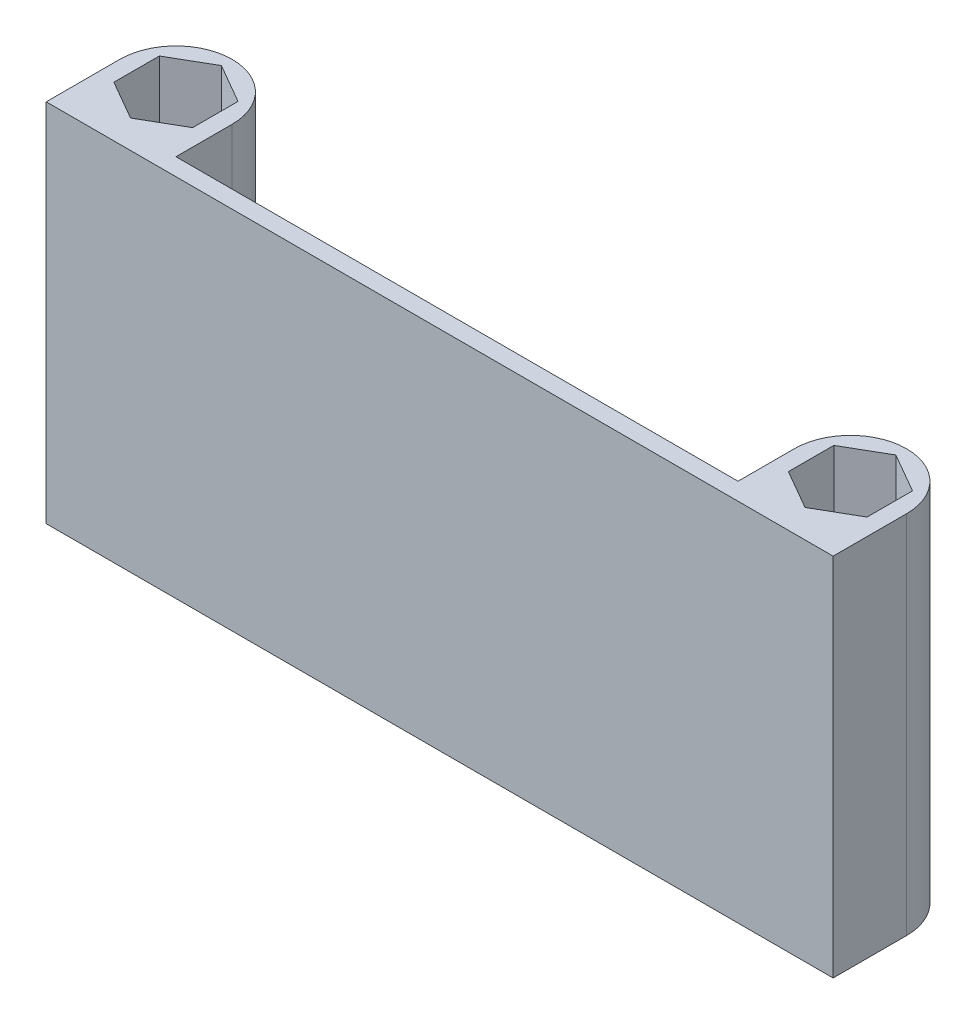
from build123d import *

# Parameters (mm, degrees)
BOSS_EXTRUDE1_DEPTH = 26
BOSS_EXTRUDE2_DEPTH = 2


with BuildPart() as part:
    # Sketch1 → Boss-Extrude1 (new body)
    with BuildSketch(Plane(origin=(0, 0, 0), x_dir=(1, 0, 0), z_dir=(0, 1, 0))):
        with BuildLine():
            Line((-28, 0), (-28, -5.233161507))
            Line((-28, -5.233161507), (28, -5.233161507))
            Line((28, -5.233161507), (28, 0))
            ThreePointArc((28, 0), (24, 4), (20, 0))
            Line((20, 0), (20, -4))
            Line((20, -4), (-20, -4))
            Line((-20, -4), (-20, 0))
            ThreePointArc((-20, 0), (-24, 4), (-28, 0))
        make_face()
        Polygon((-24, -3.233161507), (-21.2, -1.616580754), (-21.2, 1.616580754), (-24, 3.233161507), (-26.8, 1.616580754), (-26.8, -1.616580754), align=None, mode=Mode.SUBTRACT)
        Polygon((24, -3.233161507), (26.8, -1.616580754), (26.8, 1.616580754), (24, 3.233161507), (21.2, 1.616580754), (21.2, -1.616580754), align=None, mode=Mode.SUBTRACT)
    extrude(amount=BOSS_EXTRUDE1_DEPTH)

    # Sketch2 → Boss-Extrude2 (add)
    # profile 1 of 2: a face of its own
    with BuildSketch(Plane(origin=(0, 0, 4), x_dir=(-1, 0, 0), z_dir=(0, 0, -1))):
        with BuildLine():
            Line((-13.647058824, 23), (-7.511029412, 23))
            add(Edge.make_bspline(
                [(-7.511029412, 23), (-7.275731179, 22.997981779), (-6.819798363, 22.994071112), (-6.159048704, 22.98133809), (-5.542304381, 22.952753821), (-4.97019879, 22.906571513), (-4.43999705, 22.85840676), (-3.95570662, 22.791983867), (-3.515425024, 22.714754032), (-3.113311884, 22.62754473), (-2.741946911, 22.520639825), (-2.392633853, 22.391003364), (-2.061356263, 22.237036075), (-1.749186518, 22.056973854), (-1.455538155, 21.852418481), (-1.180448032, 21.624572715), (-0.921358069, 21.373380515), (-0.680179003, 21.096140802), (-0.459212321, 20.785039798), (-0.272594718, 20.428388227), (-0.114539747, 20.02893381), (0.01166681, 19.585017574), (0.11595967, 19.100276176), (0.182028181, 18.570062266), (0.228008391, 17.997136115), (0.232808413, 17.599367786), (0.235294118, 17.393382353)],
                knots=[0, 0, 0, 0, 1.509097582, 2.924149082, 4.238183516, 5.467880876, 6.60497888, 7.652028453, 8.60175528, 9.471282623, 10.289610236, 11.077949411, 11.85853237, 12.62964082, 13.386192643, 14.150986854, 14.917998976, 15.698027796, 16.504800181, 17.359170498, 18.272796439, 19.255228546, 20.31576025, 21.449539682, 22.679237042, 24, 24, 24, 24], degree=3))
            add(Edge.make_bspline(
                [(0.235294118, 17.393382353), (0.232974752, 17.254856933), (0.228515198, 16.98850749), (0.200383988, 16.605202315), (0.149069438, 16.255170164), (0.079129695, 15.936955638), (-0.005906464, 15.649717168), (-0.117746792, 15.395642258), (-0.249513114, 15.174191871), (-0.404256499, 14.979905609), (-0.591024507, 14.809913361), (-0.814712612, 14.657824833), (-1.072004992, 14.508015165), (-1.37363652, 14.380830632), (-1.707083821, 14.248019836), (-2.08498403, 14.138316996), (-2.498813667, 14.030114219), (-2.790094496, 13.971551743), (-2.941176471, 13.941176471)],
                knots=[0, 0, 0, 0, 1.248797497, 2.401122606, 3.461961877, 4.434949853, 5.336516199, 6.157599865, 6.930603047, 7.653512509, 8.388476874, 9.197582017, 10.088252902, 11.067492471, 12.144601044, 13.32232985, 14.611142055, 16, 16, 16, 16], degree=3))
            add(Edge.make_bspline(
                [(-2.941176471, 13.941176471), (-2.770371191, 13.906426369), (-2.441331923, 13.839483779), (-1.972356815, 13.710080705), (-1.546384653, 13.563684789), (-1.161438092, 13.403562089), (-0.820288891, 13.222788974), (-0.522021254, 13.024823635), (-0.263588432, 12.811780764), (-0.05097915, 12.573648761), (0.133439784, 12.315749283), (0.287925528, 12.026254146), (0.414834382, 11.704673071), (0.522237978, 11.351932642), (0.605600404, 10.96831546), (0.663113943, 10.5516397), (0.701055467, 10.10487322), (0.704241313, 9.795426457), (0.705882353, 9.636029412)],
                knots=[0, 0, 0, 0, 1.318474424, 2.539908949, 3.677602242, 4.724633259, 5.691096321, 6.593718157, 7.429479115, 8.217211742, 9.001882654, 9.823273564, 10.69276163, 11.613722017, 12.610358031, 13.659357769, 14.794327495, 16, 16, 16, 16], degree=3))
            Line((0.705882353, 9.636029412), (0.705882353, 7.757352941))
            add(Edge.make_bspline(
                [(0.705882353, 7.757352941), (0.704799402, 7.591884318), (0.702704249, 7.27175714), (0.67738761, 6.807934298), (0.632072604, 6.377720507), (0.577490967, 5.978821137), (0.492846489, 5.615803116), (0.405671971, 5.281599354), (0.28994872, 4.983831187), (0.160842329, 4.715033057), (0.012977275, 4.472562188), (-0.158442094, 4.255363641), (-0.345211479, 4.055514692), (-0.555509379, 3.876624389), (-0.785166734, 3.715553429), (-1.037562672, 3.576418256), (-1.307049122, 3.453168174), (-1.607705683, 3.35203056), (-1.957946085, 3.265715552), (-2.377158841, 3.195476641), (-2.873785211, 3.13277364), (-3.4493738, 3.088655391), (-4.103756338, 3.047411202), (-4.83799783, 3.018157261), (-5.650694295, 3.005897294), (-6.218135233, 3.002024237), (-6.514705882, 3)],
                knots=[0, 0, 0, 0, 1.152396282, 2.229506502, 3.233379135, 4.165256051, 5.030866667, 5.828132484, 6.56839727, 7.251703786, 7.90313474, 8.541689401, 9.175664088, 9.805199082, 10.461088127, 11.125968039, 11.809754162, 12.52233939, 13.331757138, 14.319645788, 15.481015661, 16.817142782, 18.339330194, 20.047761731, 21.934379081, 24, 24, 24, 24], degree=3))
            Line((-6.514705882, 3), (-13.647058824, 3))
            Line((-13.647058824, 3), (-13.647058824, 23))
        make_face()
        with BuildLine():
            Line((-7.529411765, 19.705882353), (-7.529411765, 15.235294118))
            add(Edge.make_bspline(
                [(-7.529411765, 15.235294118), (-7.406866635, 15.237978484), (-7.192422866, 15.242675901), (-6.977943364, 15.24522929), (-6.886029412, 15.246323529)],
                knots=[0, 0, 0, 0, 1.142911548, 2, 2, 2, 2], degree=3))
            add(Edge.make_bspline(
                [(-6.886029412, 15.246323529), (-6.740947301, 15.248687273), (-6.477856737, 15.252973663), (-6.125517198, 15.325927539), (-5.851081785, 15.437107788), (-5.684278021, 15.590100017), (-5.601180942, 15.752298454), (-5.553614641, 15.915978468), (-5.509206909, 16.121100191), (-5.474341123, 16.370628298), (-5.445721739, 16.665000056), (-5.423400941, 17.002143802), (-5.413861666, 17.38352185), (-5.412490731, 17.651958103), (-5.411764706, 17.794117647)],
                knots=[0, 0, 0, 0, 1.48265011, 2.688624062, 3.665886862, 4.482415445, 4.937118978, 5.516533753, 6.222944153, 7.08542788, 8.094324435, 9.251250026, 10.544306002, 12, 12, 12, 12], degree=3))
            add(Edge.make_bspline(
                [(-5.411764706, 17.794117647), (-5.414328018, 17.940093199), (-5.419057143, 18.209407536), (-5.458346473, 18.577258961), (-5.518349704, 18.87773136), (-5.617120488, 19.109882781), (-5.733904141, 19.290128296), (-5.868891145, 19.428124069), (-6.017897311, 19.536117272), (-6.198796129, 19.605125943), (-6.426159943, 19.646746329), (-6.722318383, 19.677870943), (-7.099011903, 19.698357172), (-7.37742421, 19.703224978), (-7.529411765, 19.705882353)],
                knots=[0, 0, 0, 0, 1.519775244, 2.803875429, 3.850524394, 4.696904465, 5.415553468, 6.074478191, 6.697696669, 7.316323432, 8.072315065, 9.09987747, 10.416799398, 12, 12, 12, 12], degree=3))
        make_face(mode=Mode.SUBTRACT)
        with BuildLine():
            Line((-7.529411765, 12.176470588), (-7.529411765, 6.294117647))
            add(Edge.make_bspline(
                [(-7.529411765, 6.294117647), (-7.420324785, 6.298478074), (-7.213005859, 6.306765029), (-6.918337489, 6.326902982), (-6.654951975, 6.361663585), (-6.420932841, 6.399065544), (-6.218252281, 6.450542123), (-6.047062066, 6.509147737), (-5.904616172, 6.57395291), (-5.788177353, 6.653131279), (-5.695063658, 6.755503737), (-5.618691129, 6.883359348), (-5.55127953, 7.03989887), (-5.504628482, 7.228008812), (-5.457915355, 7.44189207), (-5.430019896, 7.68684309), (-5.417623422, 7.96064691), (-5.413774101, 8.153174564), (-5.411764706, 8.253676471)],
                knots=[0, 0, 0, 0, 1.50566656, 2.861507154, 4.071047619, 5.168542278, 6.12771314, 6.950823291, 7.661450358, 8.28034255, 8.878344747, 9.553732332, 10.32599646, 11.219809833, 12.220801373, 13.344401423, 14.613743465, 16, 16, 16, 16], degree=3))
            Line((-5.411764706, 8.253676471), (-5.411764706, 10.216911765))
            add(Edge.make_bspline(
                [(-5.411764706, 10.216911765), (-5.411625539, 10.323574104), (-5.411361354, 10.526054691), (-5.431934549, 10.812872087), (-5.455941272, 11.068312667), (-5.490634178, 11.28988458), (-5.538399387, 11.478501022), (-5.596797759, 11.632421229), (-5.660721533, 11.759017199), (-5.746931785, 11.854699599), (-5.860081356, 11.921764358), (-5.99584109, 11.985178234), (-6.168589838, 12.034357698), (-6.373799547, 12.077524186), (-6.614452953, 12.113799181), (-6.88926906, 12.14220067), (-7.198264679, 12.164205556), (-7.415407511, 12.172248096), (-7.529411765, 12.176470588)],
                knots=[0, 0, 0, 0, 1.448679605, 2.750075608, 3.904849468, 4.934080626, 5.79427915, 6.542621099, 7.168507459, 7.710604877, 8.264840309, 8.942819976, 9.743425019, 10.697014228, 11.792022656, 13.047885967, 14.450082115, 16, 16, 16, 16], degree=3))
        make_face(mode=Mode.SUBTRACT)
    # profile 2 of 2: a face of its own
    with BuildSketch(Plane(origin=(0, 0, 4), x_dir=(-1, 0, 0), z_dir=(0, 0, -1))):
        with BuildLine():
            Line((11.764705882, 23), (11.764705882, 3))
            Line((11.764705882, 3), (5.882352941, 3))
            Line((5.882352941, 3), (5.882352941, 13.639705882))
            add(Edge.make_bspline(
                [(5.882352941, 13.639705882), (5.880947737, 13.82230104), (5.878288215, 14.167884759), (5.877255074, 14.65816143), (5.865236193, 15.090768646), (5.851316968, 15.465840003), (5.833299033, 15.783338952), (5.812277963, 16.043366084), (5.787966916, 16.246039236), (5.751675327, 16.439313374), (5.671063802, 16.635997331), (5.513570677, 16.831585631), (5.300972739, 16.994325057), (5.081905966, 17.105669586), (4.863856573, 17.175428694), (4.65061388, 17.221357274), (4.394651874, 17.266432937), (4.092334468, 17.296767422), (3.746641909, 17.32251546), (3.355542137, 17.340185318), (2.920406806, 17.351060405), (2.615203504, 17.352296115), (2.455882353, 17.352941176)],
                knots=[0, 0, 0, 0, 1.706209308, 3.229210257, 4.580842603, 5.749723113, 6.736155842, 7.552061302, 8.186936249, 8.642816617, 9.387119351, 10.145384432, 10.960888028, 11.872433023, 12.426467721, 13.095924105, 13.909173589, 14.853778768, 15.933135423, 17.148271002, 18.511350491, 20, 20, 20, 20], degree=3))
            Line((2.455882353, 17.352941176), (1.882352941, 17.352941176))
            Line((1.882352941, 17.352941176), (1.882352941, 19.647058824))
            add(Edge.make_bspline(
                [(1.882352941, 19.647058824), (2.221677388, 19.719791453), (2.884869887, 19.861943704), (3.838958585, 20.14553208), (4.730122825, 20.484470888), (5.558298884, 20.876645002), (6.325128134, 21.323798016), (7.029371007, 21.823696326), (7.671429441, 22.379342308), (8.048042826, 22.79388857), (8.235294118, 23)],
                knots=[0, 0, 0, 0, 1.137311521, 2.22281794, 3.259150006, 4.260062448, 5.223308807, 6.165267245, 7.087775173, 8, 8, 8, 8], degree=3))
            Line((8.235294118, 23), (11.764705882, 23))
        make_face()
    extrude(amount=BOSS_EXTRUDE2_DEPTH)


solid = part.part
